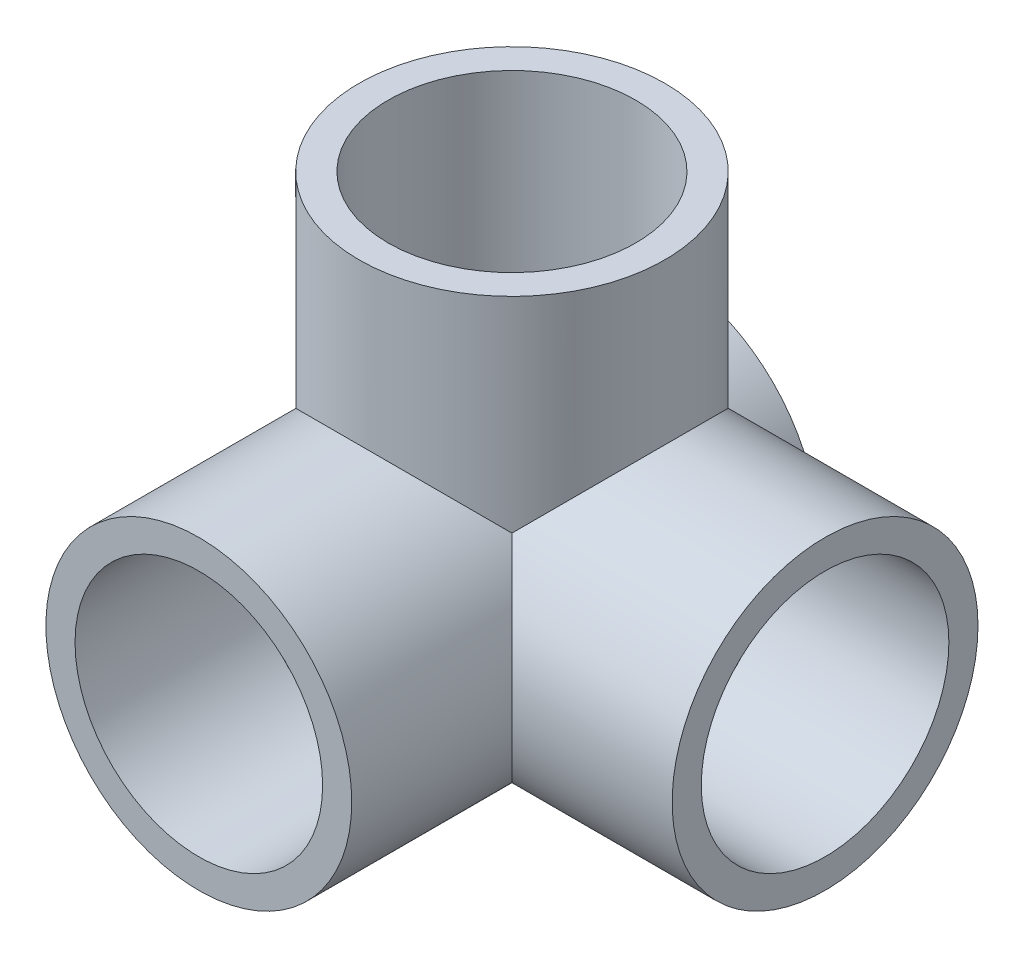
from build123d import *

# Parameters (mm, degrees)
SKETCH1_R               = 16.66875
BOSS_EXTRUDE1_DEPTH     = 50.8
SKETCH2_R               = 16.66875
BOSS_EXTRUDE2_DEPTH     = 34.13125
SKETCH3_R               = 16.66875
BOSS_EXTRUDE3_DEPTH     = 34.13125
CUT_EXTRUDE1_DEPTH      = 71.075134343
CUT_EXTRUDE1_DEPTH_BACK = 71.075134343
CUT_EXTRUDE2_DEPTH      = 80.537552304
SKETCH8_R               = 12.7
CUT_EXTRUDE3_DEPTH      = 44.45
SKETCH9_R               = 13.49375
CUT_EXTRUDE4_DEPTH      = 19.05
SKETCH10_R              = 12.7
CUT_EXTRUDE5_DEPTH      = 44.45
SKETCH11_R              = 13.49375
CUT_EXTRUDE6_DEPTH      = 19.05
SKETCH12_R              = 12.7
CUT_EXTRUDE7_DEPTH      = 44.45
SKETCH13_R              = 13.49375
CUT_EXTRUDE8_DEPTH      = 19.05


with BuildPart() as part:
    # Sketch1 → Boss-Extrude1 (new body)
    with BuildSketch(Plane.XY):
        Circle(SKETCH1_R)
    extrude(amount=BOSS_EXTRUDE1_DEPTH)

    # Sketch2 → Boss-Extrude2 (add)
    with BuildSketch(Plane(origin=(0, 0, 0), x_dir=(0, 0, -1), z_dir=(1, 0, 0))):
        with Locations((-16.66875, 0)):
            Circle(SKETCH2_R)
    extrude(amount=BOSS_EXTRUDE2_DEPTH)

    # Sketch3 → Boss-Extrude3 (add)
    with BuildSketch(Plane(origin=(0, 0, 0), x_dir=(1, 0, 0), z_dir=(0, 1, 0))):
        with Locations(Location((0, -16.66875, 0), (0, 0, 90))):
            Circle(SKETCH3_R)
    extrude(amount=BOSS_EXTRUDE3_DEPTH)

    # Sketch4 → Cut-Extrude1 (cut, two sides: drawn at the far end of the back side and taken through both)
    with BuildSketch(Plane(origin=(0, 0, 0), x_dir=(1, 0, 0), z_dir=(0, 1, 0)).offset(-CUT_EXTRUDE1_DEPTH_BACK)):
        with BuildLine():
            Line((-16.66875, -16.66875), (-16.66875, 0))
            Line((-16.66875, 0), (0, 0))
            ThreePointArc((0, 0), (-11.786586159, -4.882163841), (-16.66875, -16.66875))
        make_face()
    extrude(amount=CUT_EXTRUDE1_DEPTH + CUT_EXTRUDE1_DEPTH_BACK, mode=Mode.SUBTRACT)

    # Sketch5 → Cut-Extrude2 (cut, through all)
    with BuildSketch(Plane(origin=(34.13125, 0, 0), x_dir=(0, 0, -1), z_dir=(1, 0, 0))):
        with BuildLine():
            Line((-16.66875, -16.66875), (0, -16.66875))
            Line((0, -16.66875), (0, 0))
            ThreePointArc((0, 0), (-4.882163841, -11.786586159), (-16.66875, -16.66875))
        make_face()
    extrude(amount=-CUT_EXTRUDE2_DEPTH, mode=Mode.SUBTRACT)

    # Sketch8 → Cut-Extrude3 (cut)
    with BuildSketch(Plane(origin=(0, 34.13125, 0), x_dir=(1, 0, 0), z_dir=(0, 1, 0))):
        with Locations(Location((0, -16.66875, 0), (0, 0, 270))):
            Circle(SKETCH8_R)
    extrude(amount=-CUT_EXTRUDE3_DEPTH, mode=Mode.SUBTRACT)

    # Sketch9 → Cut-Extrude4 (cut)
    with BuildSketch(Plane(origin=(0, 34.13125, 0), x_dir=(1, 0, 0), z_dir=(0, 1, 0))):
        with Locations(Location((0, -16.66875, 0), (0, 0, 270))):
            Circle(SKETCH9_R)
    extrude(amount=-CUT_EXTRUDE4_DEPTH, mode=Mode.SUBTRACT)

    # Sketch10 → Cut-Extrude5 (cut)
    with BuildSketch(Plane(origin=(34.13125, 0, 0), x_dir=(0, 0, -1), z_dir=(1, 0, 0))):
        with Locations((-16.66875, 0)):
            Circle(SKETCH10_R)
    extrude(amount=-CUT_EXTRUDE5_DEPTH, mode=Mode.SUBTRACT)

    # Sketch11 → Cut-Extrude6 (cut)
    with BuildSketch(Plane(origin=(34.13125, 0, 0), x_dir=(0, 0, -1), z_dir=(1, 0, 0))):
        with Locations((-16.66875, 0)):
            Circle(SKETCH11_R)
    extrude(amount=-CUT_EXTRUDE6_DEPTH, mode=Mode.SUBTRACT)

    # Sketch12 → Cut-Extrude7 (cut)
    with BuildSketch(Plane.XY.offset(50.8)):
        Circle(SKETCH12_R)
    extrude(amount=-CUT_EXTRUDE7_DEPTH, mode=Mode.SUBTRACT)

    # Sketch13 → Cut-Extrude8 (cut)
    with BuildSketch(Plane.XY.offset(50.8)):
        Circle(SKETCH13_R)
    extrude(amount=-CUT_EXTRUDE8_DEPTH, mode=Mode.SUBTRACT)


solid = part.part
